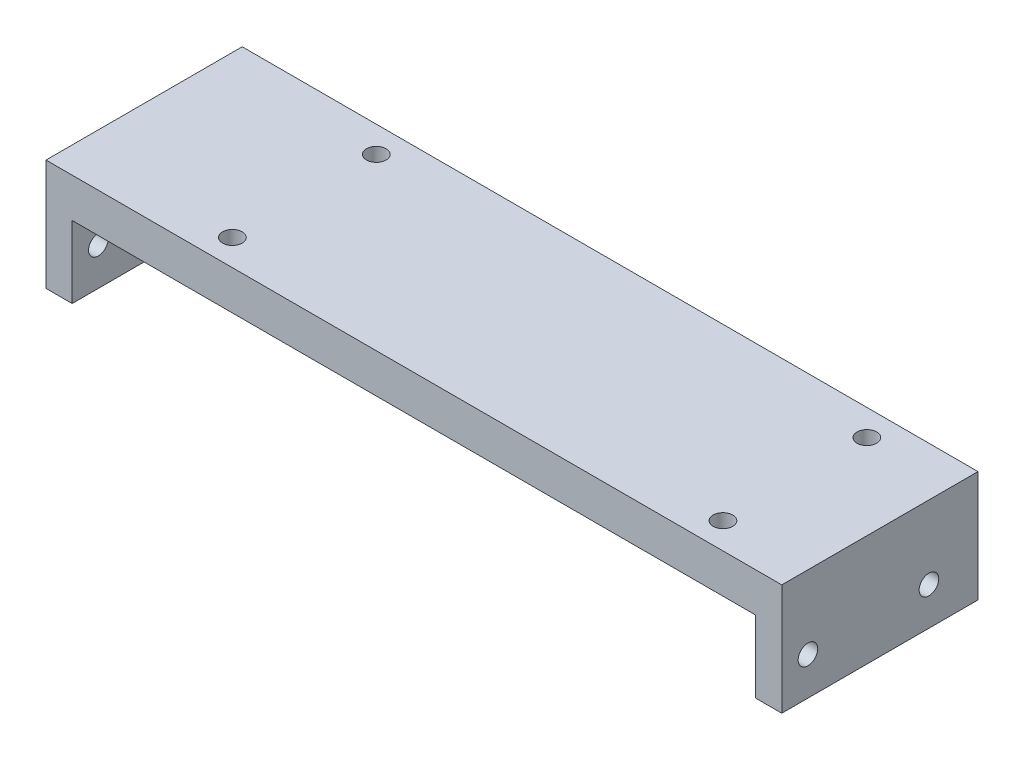
from build123d import *

# Parameters (mm, degrees)
SKETCH_1_W      = 104.5
SKETCH_1_H      = 30
SKETCH_1_R      = 1.5
EXTRUDE_1_DEPTH = 6
SKETCH_2_W      = 30
SKETCH_2_H      = 17
SKETCH_2_R      = 1.5
EXTRUDE_2_DEPTH = 4
EXTRUDE_START   = 4
SKETCH_3_W      = 30
SKETCH_3_H      = 17
SKETCH_3_R      = 1.5
EXTRUDE_3_DEPTH = 4


with BuildPart() as part:
    # 草图1 → 凸台-拉伸1 (new body)
    with BuildSketch(Plane(origin=(0, 0, 0), x_dir=(1, 0, 0), z_dir=(0, 1, 0))):
        Rectangle(SKETCH_1_W, SKETCH_1_H)
        with Locations(Location((-31.75, 11, 0), (0, 0, 270))):
            Circle(SKETCH_1_R, mode=Mode.SUBTRACT)
        with Locations(Location((43.25, 11, 0), (0, 0, 270))):
            Circle(SKETCH_1_R, mode=Mode.SUBTRACT)
        with Locations(Location((43.25, -11, 0), (0, 0, 90))):
            Circle(SKETCH_1_R, mode=Mode.SUBTRACT)
        with Locations(Location((-31.75, -11, 0), (0, 0, 90))):
            Circle(SKETCH_1_R, mode=Mode.SUBTRACT)
    extrude(amount=EXTRUDE_1_DEPTH)

    # 草图2 → 凸台-拉伸2 (add)
    with BuildSketch(Plane.ZY.offset(52.25)):
        with Locations((0, -2.5)):
            Rectangle(SKETCH_2_W, SKETCH_2_H)
        with Locations((11, -5.2)):
            Circle(SKETCH_2_R, mode=Mode.SUBTRACT)
        with Locations(Location((-11, -5.2, 0), (0, 0, 180))):
            Circle(SKETCH_2_R, mode=Mode.SUBTRACT)
    extrude(amount=EXTRUDE_2_DEPTH)

    # 草图3 → 凸台-拉伸3 (add)
    with BuildSketch(Plane(origin=(52.25, 0, 0), x_dir=(0, 0, -1), z_dir=(1, 0, 0)).offset(EXTRUDE_START)):
        with Locations((0, -2.5)):
            Rectangle(SKETCH_3_W, SKETCH_3_H)
        with Locations(Location((-11, -5.2, 0), (0, 0, 180))):
            Circle(SKETCH_3_R, mode=Mode.SUBTRACT)
        with Locations((7.5, -5.2)):
            Circle(SKETCH_3_R, mode=Mode.SUBTRACT)
    extrude(amount=-EXTRUDE_3_DEPTH)


solid = part.part
